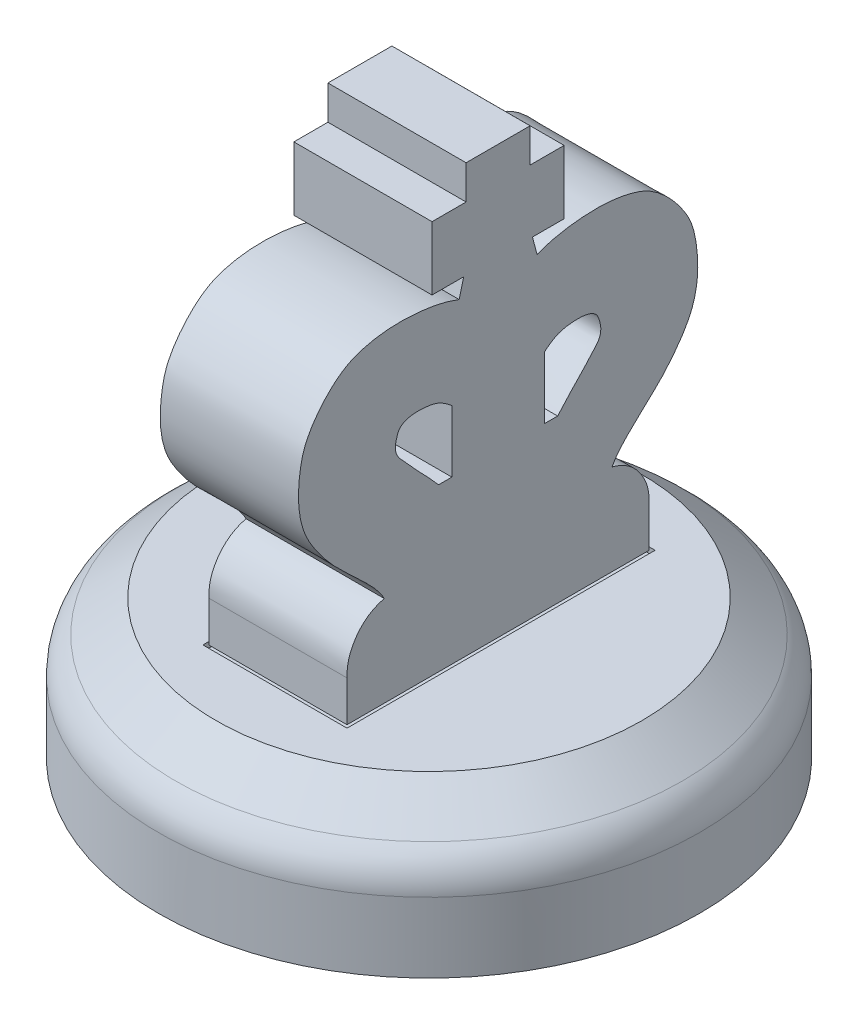
from build123d import *

# Parameters (mm, degrees)
SKETCH1_R                  = 18.653125
BOSS_EXTRUDE1_DEPTH        = 6.35
FILLET1_R                  = 3.175
SKETCH3_W                  = 12.9032
SKETCH3_H                  = 19.2532
CUT_EXTRUDE1_DEPTH         = 2.38125
F_6_0_204_DIAMETER_HOLE1_D = 5.1816
BOSS_EXTRUDE2_DEPTH        = 4.7625
SKETCH7_W                  = 9.9314
SKETCH7_H                  = 21.2344
CUT_EXTRUDE2_DEPTH         = 0.396875


with BuildPart() as part:
    # Sketch1 → Boss-Extrude1 (new body)
    with BuildSketch(Plane(origin=(0, 0, 0), x_dir=(1, 0, 0), z_dir=(0, 1, 0))):
        with Locations(Location((0, 0, 0), (0, 0, 270))):
            Circle(SKETCH1_R)
    extrude(amount=BOSS_EXTRUDE1_DEPTH)

    # Sketch2 → Revolve1 (revolve)
    with BuildSketch(Plane.XY, mode=Mode.PRIVATE) as revolve1_sk:
        Polygon((-18.653125, 6.35), (-14.684375, 9.525), (0, 9.525), (0, 6.35), align=None)
    revolve(revolve1_sk.sketch.rotate(Axis((0, 9.525, 0), (0, -1, 0)), 270), axis=Axis((0, 9.525, 0), (0, -1, 0)))

    # Fillet1
    fillet1_edges = [part.edges().sort_by_distance(p)[0] for p in [
        (0, 6.35, -18.653125),
    ]]
    fillet(fillet1_edges, radius=FILLET1_R)

    # Sketch3 → Cut-Extrude1 (cut, symmetric)
    with BuildSketch(Plane.XZ):
        Rectangle(SKETCH3_W, SKETCH3_H)
    extrude(amount=CUT_EXTRUDE1_DEPTH, both=True, mode=Mode.SUBTRACT)

    # #6 (0.204) Diameter Hole1 (through all)
    with Locations(Plane(origin=(0, 2.38125, 0), x_dir=(-1, 0, 0), z_dir=(0, -1, 0))):
        with Locations((0, 0)):
            Hole(F_6_0_204_DIAMETER_HOLE1_D / 2)

    # Sketch7 → Cut-Extrude2 (cut)
    with BuildSketch(Plane(origin=(0, 9.525, 0), x_dir=(1, 0, 0), z_dir=(0, 1, 0))):
        Rectangle(SKETCH7_W, SKETCH7_H)
    extrude(amount=-CUT_EXTRUDE2_DEPTH, mode=Mode.SUBTRACT)


with BuildPart() as body_2:
    # Sketch6 → Boss-Extrude2 (new, symmetric)
    with BuildSketch(Plane(origin=(0, 0, 0), x_dir=(0, 0, -1), z_dir=(1, 0, 0))):
        with BuildLine():
            Line((-10.414, 9.525), (10.414, 9.525))
            Line((10.414, 9.525), (10.414, 12.319))
            add(Edge.make_bspline(
                [(10.414, 12.319), (10.414, 12.625287573), (10.371667369, 13.406964275), (9.885757454, 14.402839912), (9.028588556, 15.323260467), (8.323227211, 15.667269394), (7.846654217, 15.775823925)],
                knots=[0, 0, 0, 0, 0.191943751, 0.510715935, 0.68389574, 1, 1, 1, 1], degree=3))
            add(Edge.make_bspline(
                [(7.846654217, 15.775823925), (8.205033548, 16.4445123), (9.030173215, 17.270097895), (10.367300223, 18.531439576), (11.506441863, 19.600593274), (12.554618766, 20.952853725), (13.356720714, 22.257928697), (13.814116346, 24.043872705), (13.759942749, 25.845069503), (13.434492623, 27.468424658), (12.823485642, 28.607913269), (12.132904298, 29.528328448), (11.278159238, 30.398102844), (10.294793743, 31.09598337), (9.251297565, 31.450042035), (7.615915473, 31.783134316), (5.396677236, 31.758505405), (3.535577292, 31.383938111), (2.687389519, 31.043818914)],
                knots=[0, 0, 0, 0, 0.085093592, 0.132048037, 0.20946627, 0.262245482, 0.326558193, 0.382120585, 0.469326689, 0.529647412, 0.568484945, 0.615345474, 0.660219557, 0.70691091, 0.750975595, 0.784442114, 0.896708947, 1, 1, 1, 1], degree=3))
            Line((2.687389519, 31.043818914), (2.367713572, 32.24494658))
            Line((2.367713572, 32.24494658), (4.552516721, 32.24494658))
            Line((4.552516721, 32.24494658), (4.552516721, 36.623942991))
            Line((4.552516721, 36.623942991), (2.206165697, 36.623942991))
            Line((2.206165697, 36.623942991), (2.206165697, 38.967448341))
            Line((2.206165697, 38.967448341), (-2.206165697, 38.967448341))
            Line((-2.206165697, 38.967448341), (-2.206165697, 36.623942991))
            Line((-2.206165697, 36.623942991), (-4.552516721, 36.623942991))
            Line((-4.552516721, 36.623942991), (-4.552516721, 32.24494658))
            Line((-4.552516721, 32.24494658), (-2.367713572, 32.24494658))
            Line((-2.367713572, 32.24494658), (-2.687389519, 31.043818914))
            add(Edge.make_bspline(
                [(-7.846654217, 15.775823925), (-8.205033548, 16.4445123), (-9.030173215, 17.270097895), (-10.367300223, 18.531439576), (-11.506441863, 19.600593274), (-12.554618766, 20.952853725), (-13.356720714, 22.257928697), (-13.814116346, 24.043872705), (-13.759942749, 25.845069503), (-13.434492623, 27.468424658), (-12.823485642, 28.607913269), (-12.132904298, 29.528328448), (-11.278159238, 30.398102844), (-10.294793743, 31.09598337), (-9.251297565, 31.450042035), (-7.615915473, 31.783134316), (-5.396677236, 31.758505405), (-3.535577292, 31.383938111), (-2.687389519, 31.043818914)],
                knots=[0, 0, 0, 0, 0.085093592, 0.132048037, 0.20946627, 0.262245482, 0.326558193, 0.382120585, 0.469326689, 0.529647412, 0.568484945, 0.615345474, 0.660219557, 0.70691091, 0.750975595, 0.784442114, 0.896708947, 1, 1, 1, 1], degree=3))
            add(Edge.make_bspline(
                [(-10.414, 12.319), (-10.414, 12.625287573), (-10.371667369, 13.406964275), (-9.885757454, 14.402839912), (-9.028588556, 15.323260467), (-8.323227211, 15.667269394), (-7.846654217, 15.775823925)],
                knots=[0, 0, 0, 0, 0.191943751, 0.510715935, 0.68389574, 1, 1, 1, 1], degree=3))
            Line((-10.414, 12.319), (-10.414, 9.525))
        make_face()
        with BuildLine():
            Line((-3.186264633, 20.693260232), (-3.186264633, 24.964857672))
            add(Edge.make_bspline(
                [(-3.186264633, 24.964857672), (-3.496110079, 25.231215789), (-4.098640049, 25.660720042), (-5.142701618, 25.805824845), (-5.956644147, 25.815984428), (-6.561200449, 25.616012815), (-6.872026059, 25.316200381), (-6.993972235, 24.942819361), (-7.09597015, 24.531556258), (-7.069224778, 24.111586077), (-6.875274819, 23.69358972), (-6.55034022, 23.331807132), (-6.118995079, 22.877220224), (-5.693998337, 22.383971695), (-4.967740692, 21.669579588), (-4.459164569, 21.104071975), (-4.104813592, 20.693260232)],
                knots=[0, 0, 0, 0, 0.127028133, 0.218333624, 0.319362177, 0.37560628, 0.408656755, 0.447791719, 0.493913348, 0.538939693, 0.57359785, 0.633524, 0.687102481, 0.766504718, 0.833287283, 1, 1, 1, 1], degree=3))
            Line((-4.104813592, 20.693260232), (-3.186264633, 20.693260232))
        make_face(mode=Mode.SUBTRACT)
        with BuildLine():
            Line((3.186264633, 20.693260232), (4.104813592, 20.693260232))
            add(Edge.make_bspline(
                [(3.186264633, 24.964857672), (3.496110079, 25.231215789), (4.098640049, 25.660720042), (5.142701618, 25.805824845), (5.956644147, 25.815984428), (6.561200449, 25.616012815), (6.872026059, 25.316200381), (6.993972235, 24.942819361), (7.09597015, 24.531556258), (7.069224778, 24.111586077), (6.875274819, 23.69358972), (6.55034022, 23.331807132), (6.118995079, 22.877220224), (5.693998337, 22.383971695), (4.967740692, 21.669579588), (4.459164569, 21.104071975), (4.104813592, 20.693260232)],
                knots=[0, 0, 0, 0, 0.127028133, 0.218333624, 0.319362177, 0.37560628, 0.408656755, 0.447791719, 0.493913348, 0.538939693, 0.57359785, 0.633524, 0.687102481, 0.766504718, 0.833287283, 1, 1, 1, 1], degree=3))
            Line((3.186264633, 24.964857672), (3.186264633, 20.693260232))
        make_face(mode=Mode.SUBTRACT)
    extrude(amount=BOSS_EXTRUDE2_DEPTH, both=True)


solid = Compound([part.part, body_2.part])
